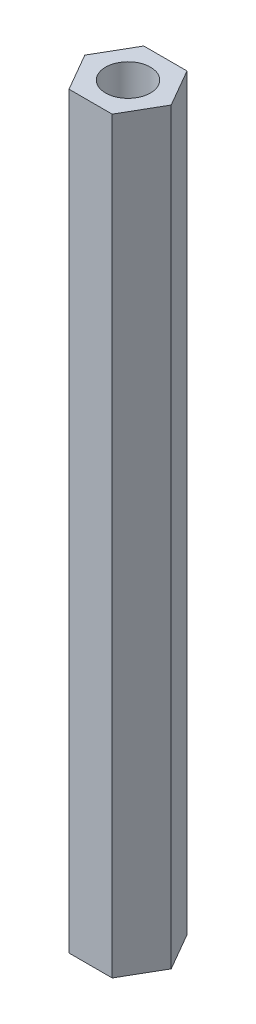
from build123d import *

# Parameters (mm, degrees)
SKETCH1_R           = 2.1
BOSS_EXTRUDE1_DEPTH = 70


with BuildPart() as part:
    # Sketch1 → Boss-Extrude1 (new body)
    with BuildSketch(Plane(origin=(0, 0, 0), x_dir=(1, 0, 0), z_dir=(0, 1, 0))):
        Polygon((4.041451884, 0), (2.020725942, 3.5), (-2.020725942, 3.5), (-4.041451884, 0), (-2.020725942, -3.5), (2.020725942, -3.5), align=None)
        with Locations(Location((0, 0, 0), (0, 0, 270))):
            Circle(SKETCH1_R, mode=Mode.SUBTRACT)
    extrude(amount=BOSS_EXTRUDE1_DEPTH)


solid = part.part
